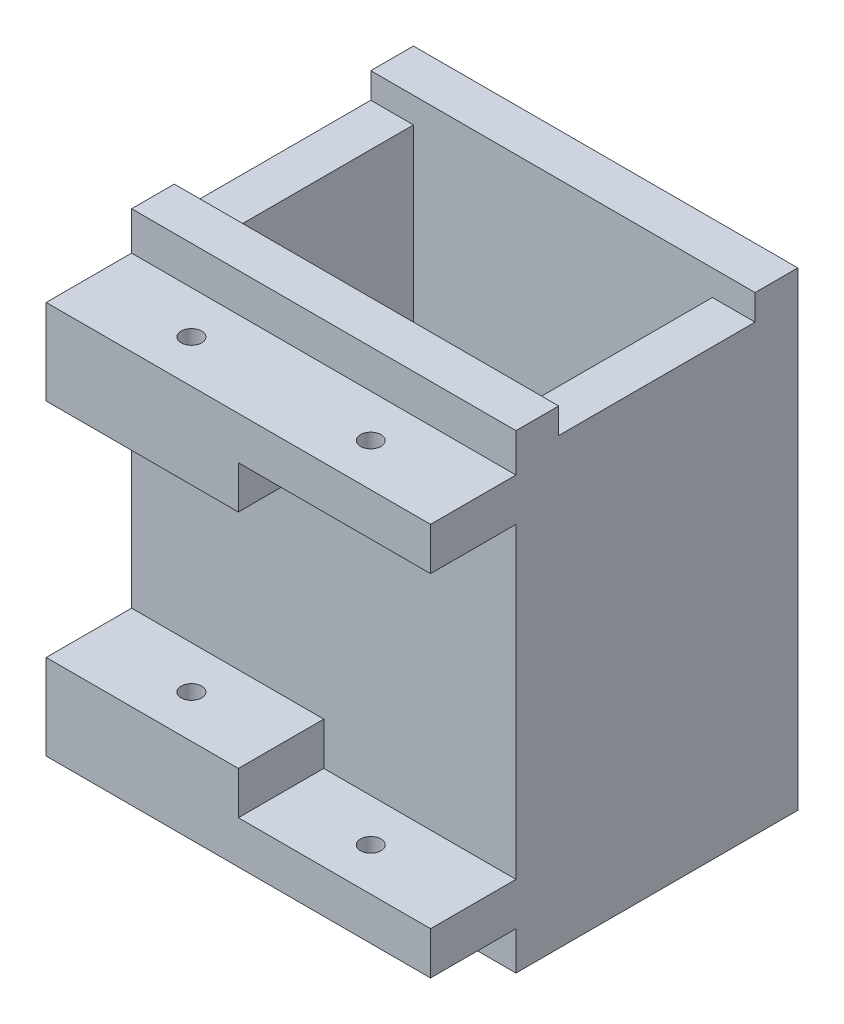
from build123d import *

# Parameters (mm, degrees)
SKETCH_1_W          = 45
SKETCH_1_H          = 50
EXTRUDE_1_DEPTH     = 43
SKETCH_2_W          = 35
SKETCH_2_H          = 23
CUT_EXTRUDE_1_DEPTH = 70.679623994
SKETCH_3_W          = 45
SKETCH_3_H          = 43
EXTRUDE_2_DEPTH     = 5
SKETCH_4_W          = 10
SKETCH_4_H          = 26
SKETCH_4_H_2        = 4.5
CUT_EXTRUDE_2_DEPTH = 70.09413868
SKETCH_5_W          = 22.5
SKETCH_5_H          = 5
CUT_EXTRUDE_3_DEPTH = 10
HOLE_WIZARD_M2_1_D  = 2.4
SKETCH_8_W          = 45
SKETCH_8_H          = 23
CUT_EXTRUDE_4_DEPTH = 3
CUT_EXTRUDE_5_REACH = 59.055
SKETCH_11_W         = 22.5
SKETCH_11_H         = 5


with BuildPart() as part:
    # ｽｹｯﾁ1 → ﾎﾞｽ - 押し出し1 (new body)
    with BuildSketch(Plane.XY):
        Rectangle(SKETCH_1_W, SKETCH_1_H)
    extrude(amount=EXTRUDE_1_DEPTH)

    # ｽｹｯﾁ2 → ｶｯﾄ - 押し出し1 (cut, through all)
    with BuildSketch(Plane(origin=(0, 25, 0), x_dir=(1, 0, 0), z_dir=(0, 1, 0))):
        with Locations((0, -16.5)):
            Rectangle(SKETCH_2_W, SKETCH_2_H)
    extrude(amount=-CUT_EXTRUDE_1_DEPTH, mode=Mode.SUBTRACT)

    # ｽｹｯﾁ3 → ﾎﾞｽ - 押し出し2 (add)
    with BuildSketch(Plane.XZ.offset(25)):
        with Locations((0, 21.5)):
            Rectangle(SKETCH_3_W, SKETCH_3_H)
    extrude(amount=EXTRUDE_2_DEPTH)

    # ｽｹｯﾁ4 → ｶｯﾄ - 押し出し2 (cut, through all)
    with BuildSketch(Plane(origin=(22.5, 0, 0), x_dir=(0, 0, -1), z_dir=(1, 0, 0))):
        with Locations((-38, -2.5)):
            Rectangle(SKETCH_4_W, SKETCH_4_H)
        with Locations((-38, -27.75)):
            Rectangle(SKETCH_4_W, SKETCH_4_H_2)
        with Locations((-38, 22.75)):
            Rectangle(SKETCH_4_W, SKETCH_4_H_2)
    extrude(amount=-CUT_EXTRUDE_2_DEPTH, mode=Mode.SUBTRACT)

    # ｽｹｯﾁ5 → ｶｯﾄ - 押し出し3 (cut)
    with BuildSketch(Plane.XY.offset(43)):
        with Locations((11.25, 13)):
            Rectangle(SKETCH_5_W, SKETCH_5_H)
    extrude(amount=-CUT_EXTRUDE_3_DEPTH, mode=Mode.SUBTRACT)

    # M2 すきま穴1 (through all)
    with Locations(Plane(origin=(0, 20.5, 0), x_dir=(1, 0, 0), z_dir=(0, 1, 0))):
        with Locations((-10.5, -38), (10.5, -38)):
            Hole(HOLE_WIZARD_M2_1_D / 2)

    # ｽｹｯﾁ8 → ｶｯﾄ - 押し出し4 (cut)
    with BuildSketch(Plane(origin=(0, 25, 0), x_dir=(1, 0, 0), z_dir=(0, 1, 0))):
        with Locations((0, -16.5)):
            Rectangle(SKETCH_8_W, SKETCH_8_H)
    extrude(amount=-CUT_EXTRUDE_4_DEPTH, mode=Mode.SUBTRACT)

    # ｶｯﾄ - 押し出し5: up to this face of the body (flat: up to its plane)
    cut_extrude_5_end = Plane(part.part.faces().sort_by_distance((0.986842105, -1.140350877, 33))[0])
    # ｽｹｯﾁ11 → ｶｯﾄ - 押し出し5 (cut, up to the picked face)
    with BuildSketch(Plane.XY.offset(43), mode=Mode.PRIVATE) as cut_extrude_5_sk1:
        with Locations((11.25, -18)):
            Rectangle(SKETCH_11_W, SKETCH_11_H)
    cut_extrude_5_tool1 = split(extrude(cut_extrude_5_sk1.sketch, amount=-CUT_EXTRUDE_5_REACH, mode=Mode.PRIVATE), bisect_by=cut_extrude_5_end, keep=Keep.BOTH, mode=Mode.PRIVATE)
    add(cut_extrude_5_tool1.solids().sort_by(Axis((11.25, -18, 43), (0, 0, -1)))[0], mode=Mode.SUBTRACT)


solid = part.part
